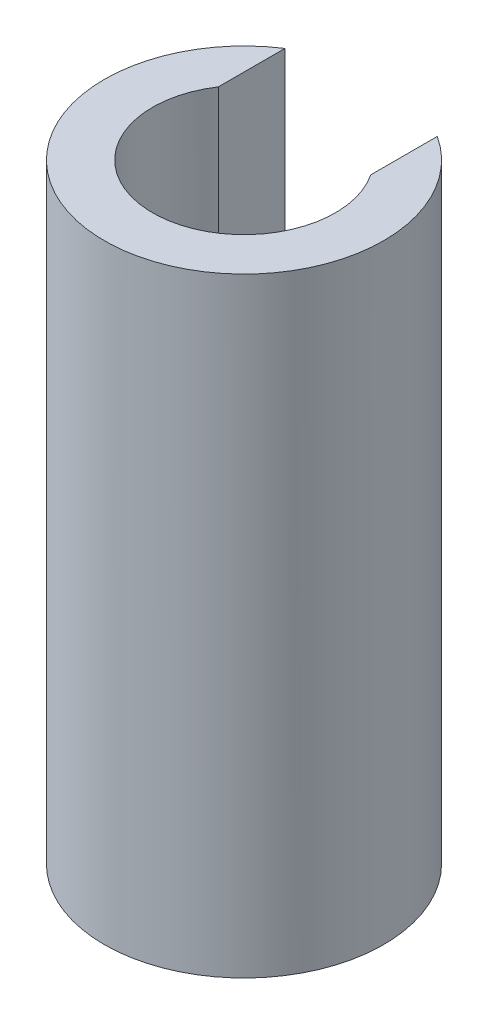
from build123d import *

# Parameters (mm, degrees)
SKETCH1_R           = 2.75
BOSS_EXTRUDE1_DEPTH = 12
SKETCH3_R           = 1.8
CUT_EXTRUDE1_DEPTH  = 12
SKETCH4_W           = 3
SKETCH4_H           = 2.75
CUT_EXTRUDE2_DEPTH  = 6


with BuildPart() as part:
    # Sketch1 → Boss-Extrude1 (new body)
    with BuildSketch(Plane(origin=(0, 0, 0), x_dir=(1, 0, 0), z_dir=(0, 1, 0))):
        with Locations(Location((0, 0, 0), (0, 0, 270))):
            Circle(SKETCH1_R)
    extrude(amount=BOSS_EXTRUDE1_DEPTH)

    # Sketch3 → Cut-Extrude1 (cut)
    with BuildSketch(Plane.XZ):
        with Locations(Location((0, 0, 0), (0, 0, 270))):
            Circle(SKETCH3_R)
    extrude(amount=-CUT_EXTRUDE1_DEPTH, mode=Mode.SUBTRACT)

    # Sketch4 → Cut-Extrude2 (cut)
    with BuildSketch(Plane(origin=(0, 12, 0), x_dir=(1, 0, 0), z_dir=(0, 1, 0))):
        with Locations((0, 1.375)):
            Rectangle(SKETCH4_W, SKETCH4_H)
    extrude(amount=-CUT_EXTRUDE2_DEPTH, mode=Mode.SUBTRACT)


solid = part.part
